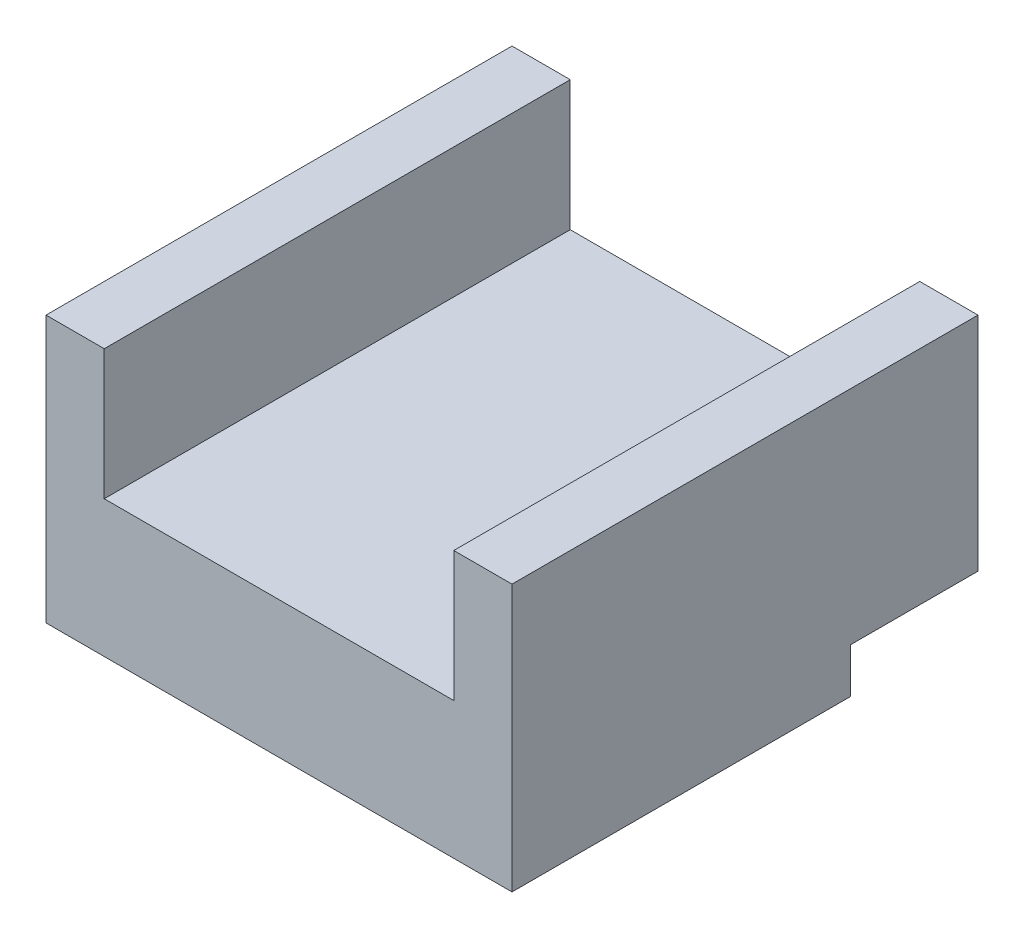
from build123d import *

# Parameters (mm, degrees)
SKETCH_1_W          = 20.8
SKETCH_1_H          = 20.8
EXTRUDE_1_DEPTH     = 6.1
EXTRUDE_START       = -6.1
SKETCH_2_W          = 2.6
SKETCH_2_H          = 20.8
EXTRUDE_2_DEPTH     = 11.9
SKETCH_3_W          = 20.8
SKETCH_3_H          = 5.7
CUT_EXTRUDE_1_DEPTH = 2


with BuildPart() as part:
    # 草图1 → 凸台-拉伸1 (new body)
    with BuildSketch(Plane(origin=(0, 0, 0), x_dir=(1, 0, 0), z_dir=(0, 1, 0))):
        Rectangle(SKETCH_1_W, SKETCH_1_H)
    extrude(amount=EXTRUDE_1_DEPTH)

    # 草图2 → 凸台-拉伸2 (add)
    with BuildSketch(Plane(origin=(0, 6.1, 0), x_dir=(1, 0, 0), z_dir=(0, 1, 0)).offset(EXTRUDE_START)):
        with Locations((-9.1, 0)):
            Rectangle(SKETCH_2_W, SKETCH_2_H)
        with Locations((9.1, 0)):
            Rectangle(SKETCH_2_W, SKETCH_2_H)
    extrude(amount=EXTRUDE_2_DEPTH)

    # 草图3 → 切除-拉伸1 (cut)
    with BuildSketch(Plane.XZ):
        with Locations((0, -7.55)):
            Rectangle(SKETCH_3_W, SKETCH_3_H)
    extrude(amount=-CUT_EXTRUDE_1_DEPTH, mode=Mode.SUBTRACT)


solid = part.part
